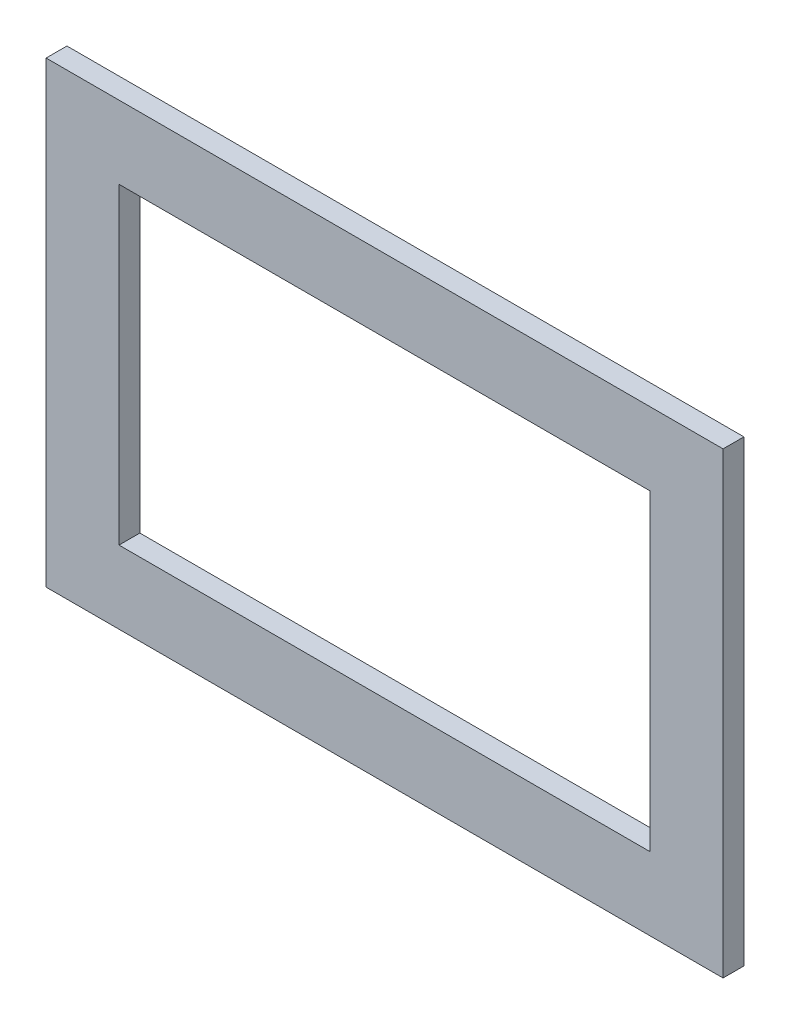
from build123d import *

# Parameters (mm, degrees)
SKETCH1_W           = 650
SKETCH1_H           = 440
SKETCH1_W_2         = 510
SKETCH1_H_2         = 300
BOSS_EXTRUDE1_DEPTH = 20


with BuildPart() as part:
    # Sketch1 → Boss-Extrude1 (new body)
    with BuildSketch(Plane.XY):
        with Locations((58.301526718, -85.919804419)):
            Rectangle(SKETCH1_W, SKETCH1_H)
        with Locations((58.301526718, -85.919804419)):
            Rectangle(SKETCH1_W_2, SKETCH1_H_2, mode=Mode.SUBTRACT)
    extrude(amount=BOSS_EXTRUDE1_DEPTH)


solid = part.part
